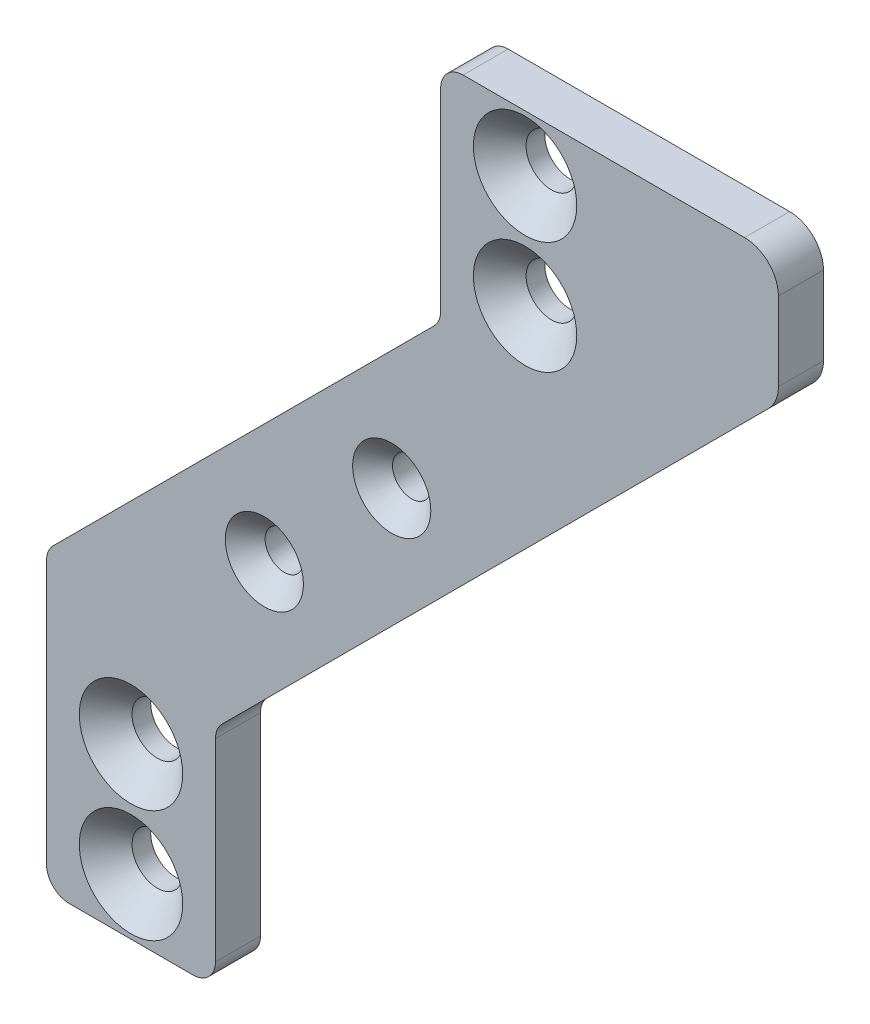
from build123d import *

# Parameters (mm, degrees)
EXTRUDE_1_DEPTH              = 4
FILLET_1_R                   = 2
HOLE_WIZARD_M4_1_D           = 4.5
HOLE_WIZARD_M4_1_DEPTH       = 24.5
HOLE_WIZARD_M4_1_CSINK_D     = 9.18
HOLE_WIZARD_M4_1_CSINK_ANGLE = 90
HOLE_WIZARD_M4_1_TIP         = 1.351936393
HOLE_WIZARD_M3_1_D           = 3.4
HOLE_WIZARD_M3_1_DEPTH       = 24.5
HOLE_WIZARD_M3_1_CSINK_D     = 6.94
HOLE_WIZARD_M3_1_CSINK_ANGLE = 90
HOLE_WIZARD_M3_1_TIP         = 1.021463052
EXTRUDE_2_DEPTH              = 4
FILLET_2_R                   = 3


with BuildPart() as part:
    # 草图1 → 凸台-拉伸1 (new body)
    with BuildSketch(Plane.XY):
        Polygon((0, 0), (-15, 0), (-15, 26.213203436), (20, 61.213203436), (20, 81.213203436), (35, 81.213203436), (35, 55), (0, 20), align=None)
    extrude(amount=EXTRUDE_1_DEPTH)

    # 圆角1
    fillet_1_edges = [part.edges().sort_by_distance(p)[0] for p in [
        (0, 0, 2),
        (-15, 0, 2),
        (-15, 26.213203436, 2),
        (20, 61.213203436, 2),
        (20, 81.213203436, 2),
        (35, 81.213203436, 2),
        (35, 55, 2),
        (0, 20, 2),
    ]]
    fillet(fillet_1_edges, radius=FILLET_1_R)

    # M4 六角凹锥坑头螺钉的锥形沉头孔1
    with Locations(Plane(origin=(27.5, 76.213203436, 4), x_dir=(1, 0, 0), z_dir=(0, 0, 1))):
        with Locations((0, 0), (0, -10), (-35, -61.213203436), (-35, -71.213203436)):
            CounterSinkHole(HOLE_WIZARD_M4_1_D / 2, HOLE_WIZARD_M4_1_CSINK_D / 2, depth=HOLE_WIZARD_M4_1_DEPTH, counter_sink_angle=HOLE_WIZARD_M4_1_CSINK_ANGLE)
            with Locations((0, 0, -(HOLE_WIZARD_M4_1_DEPTH + HOLE_WIZARD_M4_1_TIP / 2))):  # 118° drill point
                Cone(0, HOLE_WIZARD_M4_1_D / 2, HOLE_WIZARD_M4_1_TIP, mode=Mode.SUBTRACT)

    # M3 六角凹锥坑头螺钉的锥形沉头孔1
    with Locations(Plane(origin=(4.343145751, 34.949747468, 4), x_dir=(1, 0, 0), z_dir=(0, 0, 1))):
        with Locations((0, 0), (11.313708498, 11.313708499)):
            CounterSinkHole(HOLE_WIZARD_M3_1_D / 2, HOLE_WIZARD_M3_1_CSINK_D / 2, depth=HOLE_WIZARD_M3_1_DEPTH, counter_sink_angle=HOLE_WIZARD_M3_1_CSINK_ANGLE)
            with Locations((0, 0, -(HOLE_WIZARD_M3_1_DEPTH + HOLE_WIZARD_M3_1_TIP / 2))):  # 118° drill point
                Cone(0, HOLE_WIZARD_M3_1_D / 2, HOLE_WIZARD_M3_1_TIP, mode=Mode.SUBTRACT)

    # 草图6 → 凸台-拉伸2 (add)
    with BuildSketch(Plane.XY.offset(4)):
        with BuildLine():
            Line((34.414213562, 54.414213562), (50, 70))
            Line((50, 70), (50, 81.213203436))
            Line((50, 81.213203436), (33, 81.213203436))
            ThreePointArc((33, 81.213203436), (34.414213562, 80.627416998), (35, 79.213203436))
            Line((35, 79.213203436), (35, 55.828427125))
            ThreePointArc((35, 55.828427125), (34.847759065, 55.06306026), (34.414213562, 54.414213562))
        make_face()
    extrude(amount=-EXTRUDE_2_DEPTH)

    # 圆角2
    fillet_2_edges = [part.edges().sort_by_distance(p)[0] for p in [
        (50, 70, 2),
        (50, 81.213203436, 2),
    ]]
    fillet(fillet_2_edges, radius=FILLET_2_R)


solid = part.part
